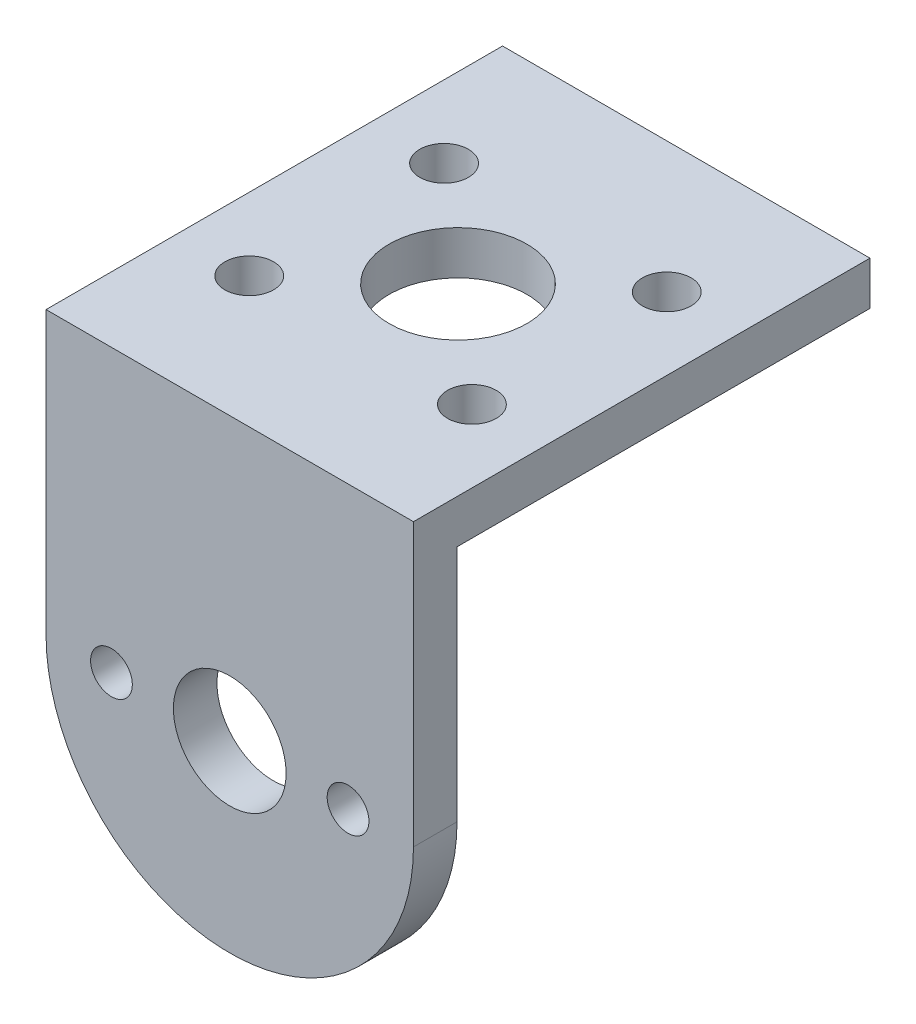
from build123d import *

# Parameters (mm, degrees)
BOSS_EXTRUDE1_DEPTH = 3.13
SKETCH2_R           = 4.05
CUT_EXTRUDE1_DEPTH  = 3.13
SKETCH3_R           = 1.5
CUT_EXTRUDE2_DEPTH  = 17
SKETCH4_W           = 26.4
SKETCH4_H           = 32.8
BOSS_EXTRUDE2_DEPTH = 3.13
SKETCH5_R           = 4.95
CUT_EXTRUDE3_DEPTH  = 3.13
SKETCH6_R           = 1.75
CUT_EXTRUDE4_DEPTH  = 3.13


with BuildPart() as part:
    # Sketch1 → Boss-Extrude1 (new body)
    with BuildSketch(Plane.XY):
        with BuildLine():
            Line((-13.2, 20.24), (-13.2, 0))
            ThreePointArc((-13.2, 0), (0, 13.2), (13.2, 0))
            Line((13.2, 0), (13.2, 20.24))
            Line((13.2, 20.24), (-13.2, 20.24))
        make_face()
        with BuildLine():
            Line((-13.2, 0), (0, 0))
            Line((0, 0), (13.2, 0))
            ThreePointArc((13.2, 0), (0, 13.2), (-13.2, 0))
        make_face()
        with BuildLine():
            Line((13.2, 0), (0, 0))
            Line((0, 0), (0, -13.2))
            ThreePointArc((0, -13.2), (9.333809512, -9.333809512), (13.2, 0))
        make_face()
        with BuildLine():
            Line((0, -13.2), (0, 0))
            Line((0, 0), (-13.2, 0))
            ThreePointArc((-13.2, 0), (-9.333809512, -9.333809512), (0, -13.2))
        make_face()
    extrude(amount=-BOSS_EXTRUDE1_DEPTH)

    # Sketch2 → Cut-Extrude1 (cut)
    with BuildSketch(Plane.XY):
        Circle(SKETCH2_R)
    extrude(amount=-CUT_EXTRUDE1_DEPTH, mode=Mode.SUBTRACT)

    # Sketch3 → Cut-Extrude2 (cut)
    with BuildSketch(Plane.XY):
        with Locations((8.5, 0)):
            Circle(SKETCH3_R)
        with Locations((-8.5, 0)):
            Circle(SKETCH3_R)
    extrude(amount=-CUT_EXTRUDE2_DEPTH, mode=Mode.SUBTRACT)

    # Sketch4 → Boss-Extrude2 (add)
    with BuildSketch(Plane(origin=(0, 20.24, 0), x_dir=(1, 0, 0), z_dir=(0, 1, 0))):
        with Locations((0, 16.4)):
            Rectangle(SKETCH4_W, SKETCH4_H)
    extrude(amount=-BOSS_EXTRUDE2_DEPTH)

    # Sketch5 → Cut-Extrude3 (cut)
    with BuildSketch(Plane(origin=(0, 20.24, 0), x_dir=(1, 0, 0), z_dir=(0, 1, 0))):
        with Locations(Location((0, 16.4, 0), (0, 0, 270))):
            Circle(SKETCH5_R)
    extrude(amount=-CUT_EXTRUDE3_DEPTH, mode=Mode.SUBTRACT)

    # Sketch6 → Cut-Extrude4 (cut)
    with BuildSketch(Plane(origin=(0, 20.24, 0), x_dir=(1, 0, 0), z_dir=(0, 1, 0))):
        with Locations(Location((8, 23.4, 0), (0, 0, 270))):
            Circle(SKETCH6_R)
        with Locations(Location((8, 9.4, 0), (0, 0, 270))):
            Circle(SKETCH6_R)
        with Locations(Location((-8, 9.4, 0), (0, 0, 270))):
            Circle(SKETCH6_R)
        with Locations(Location((-8, 23.4, 0), (0, 0, 270))):
            Circle(SKETCH6_R)
    extrude(amount=-CUT_EXTRUDE4_DEPTH, mode=Mode.SUBTRACT)


solid = part.part
